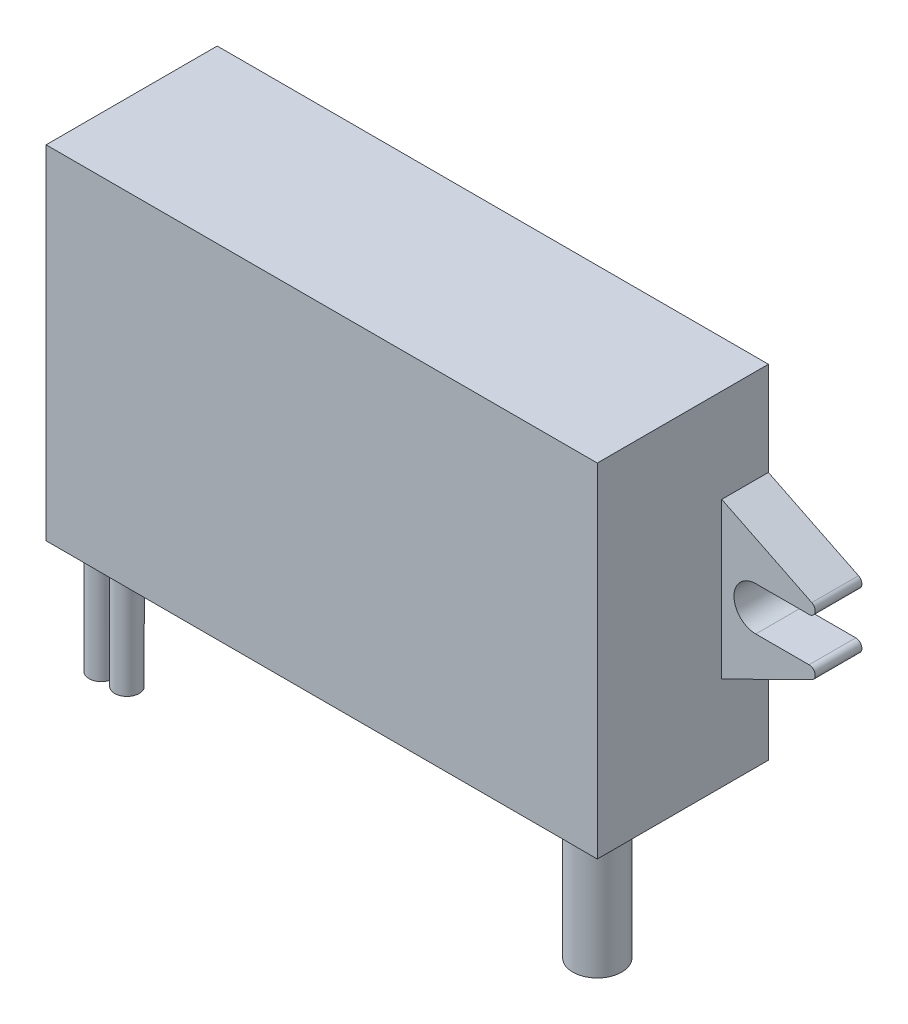
from build123d import *

# Parameters (mm, degrees)
SKETCH1_W           = 45
SKETCH1_H           = 28
BOSS_EXTRUDE1_DEPTH = 13.97
BOSS_EXTRUDE2_DEPTH = 3.81
SKETCH4_R           = 1
SKETCH4_R_2         = 2
BOSS_EXTRUDE3_DEPTH = 10


with BuildPart() as part:
    # Sketch1 → Boss-Extrude1 (new body)
    with BuildSketch(Plane.XY):
        Rectangle(SKETCH1_W, SKETCH1_H)
    extrude(amount=BOSS_EXTRUDE1_DEPTH)

    # Sketch3 → Boss-Extrude2 (add)
    with BuildSketch(Plane(origin=(0, 0, 0), x_dir=(-1, 0, 0), z_dir=(0, 0, -1))):
        with BuildLine():
            Line((-22.5, 6.35), (-29.854033425, 2.72651182))
            ThreePointArc((-29.854033425, 2.72651182), (-30.12, 2.164544965), (-29.633042142, 1.778))
            Line((-29.633042142, 1.778), (-25.278, 1.778))
            ThreePointArc((-25.278, 1.778), (-23.5, 0), (-25.278, -1.778))
            Line((-25.278, -1.778), (-29.633042142, -1.778))
            ThreePointArc((-29.633042142, -1.778), (-30.12, -2.164544965), (-29.854033425, -2.72651182))
            Line((-29.854033425, -2.72651182), (-22.5, -6.35))
            Line((-22.5, -6.35), (-22.5, 6.35))
        make_face()
    boss_extrude2 = extrude(amount=-BOSS_EXTRUDE2_DEPTH)

    # Mirror8: Boss-Extrude2 across plane
    add(boss_extrude2.mirror(Plane(origin=(0, 0, 0), x_dir=(0, 0, 1), z_dir=(1, 0, 0))))

    # Sketch4 → Boss-Extrude3 (add)
    with BuildSketch(Plane.XZ.offset(14)):
        with Locations(Location((-21, 10.97, 0), (0, 0, 90))):
            Circle(SKETCH4_R)
        with Locations(Location((-18.9, 10.97, 0), (0, 0, 90))):
            Circle(SKETCH4_R)
        with Locations(Location((19.5, 10.97, 0), (0, 0, 90))):
            Circle(SKETCH4_R_2)
    extrude(amount=BOSS_EXTRUDE3_DEPTH)


solid = part.part
